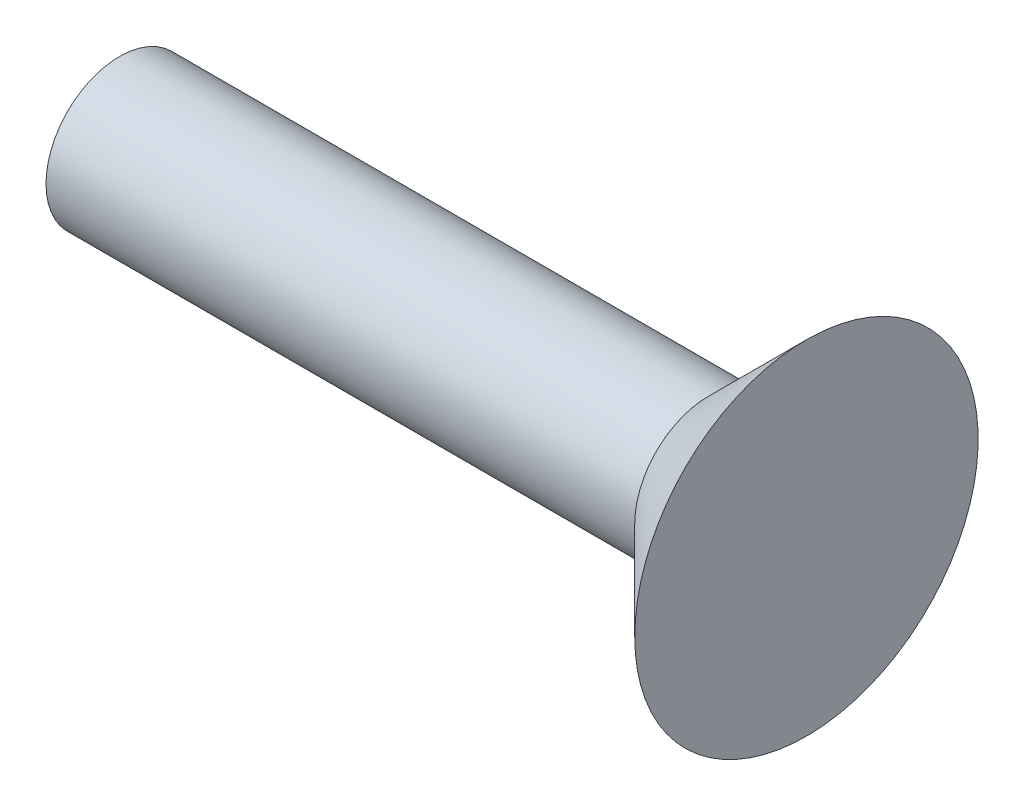
from build123d import *


with BuildPart() as part:
    # Sketch1 → Revolve2 (revolve)
    with BuildSketch(Plane.XY, mode=Mode.PRIVATE) as revolve2_sk:
        Polygon((-84.003233386, 19.234385214), (-72.003233386, 19.234385214), (-70.003233386, 21.234385214), (-70.003233386, 17.734385214), (-84.003233386, 17.734385214), align=None)
    revolve(revolve2_sk.sketch.rotate(Axis((-84.003233386, 17.734385214, 0), (1, 0, 0)), 90), axis=Axis((-84.003233386, 17.734385214, 0), (1, 0, 0)))


solid = part.part
